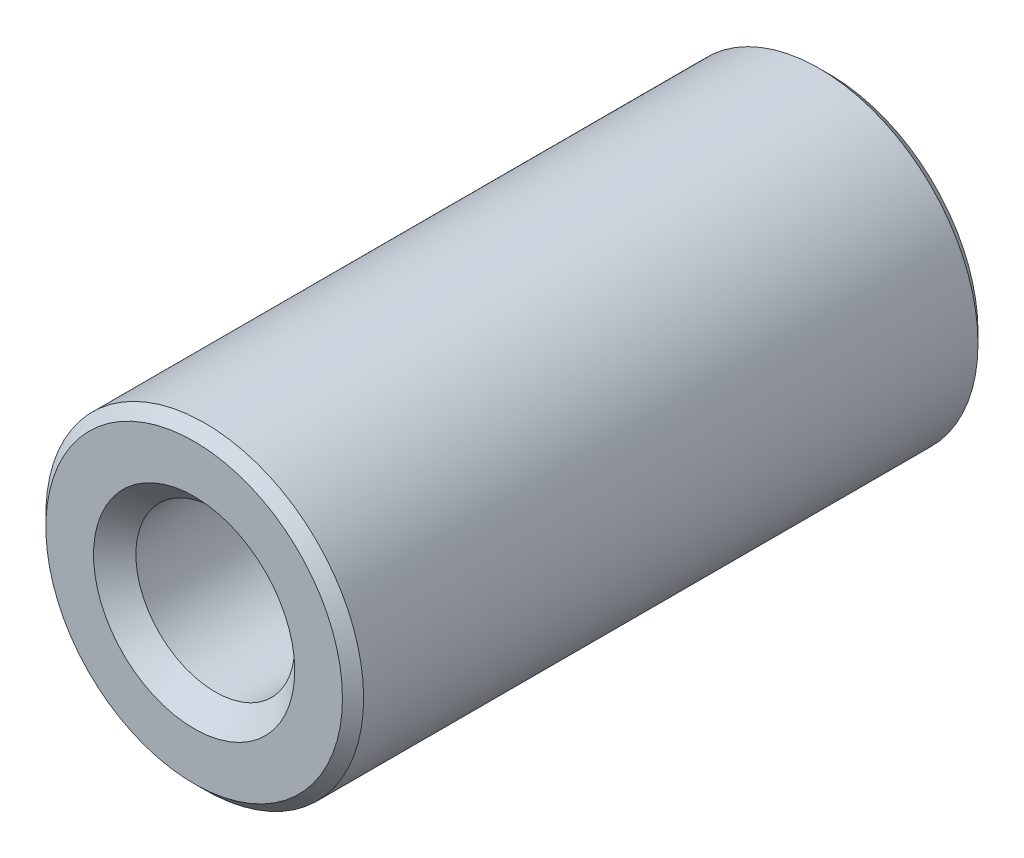
from build123d import *


with BuildPart() as part:
    # 草图1 → 旋转1 (revolve)
    with BuildSketch(Plane(origin=(0, 0, 0), x_dir=(1, 0, 0), z_dir=(0, 1, 0))):
        Polygon((1.5, -17.399940727), (0, -17.399940727), (0, -20.600059273), (1.5, -20.600059273), (1.5, -24.600059273), (1.899924924, -25), (2.79992954, -25), (3, -24.799924505), (3, -13.200041756), (2.799961089, -13), (1.899924924, -13), (1.5, -13.399940727), align=None)
    revolve(axis=Axis((0, 0, -25.003051641), (0, 0, 1)))


solid = part.part
